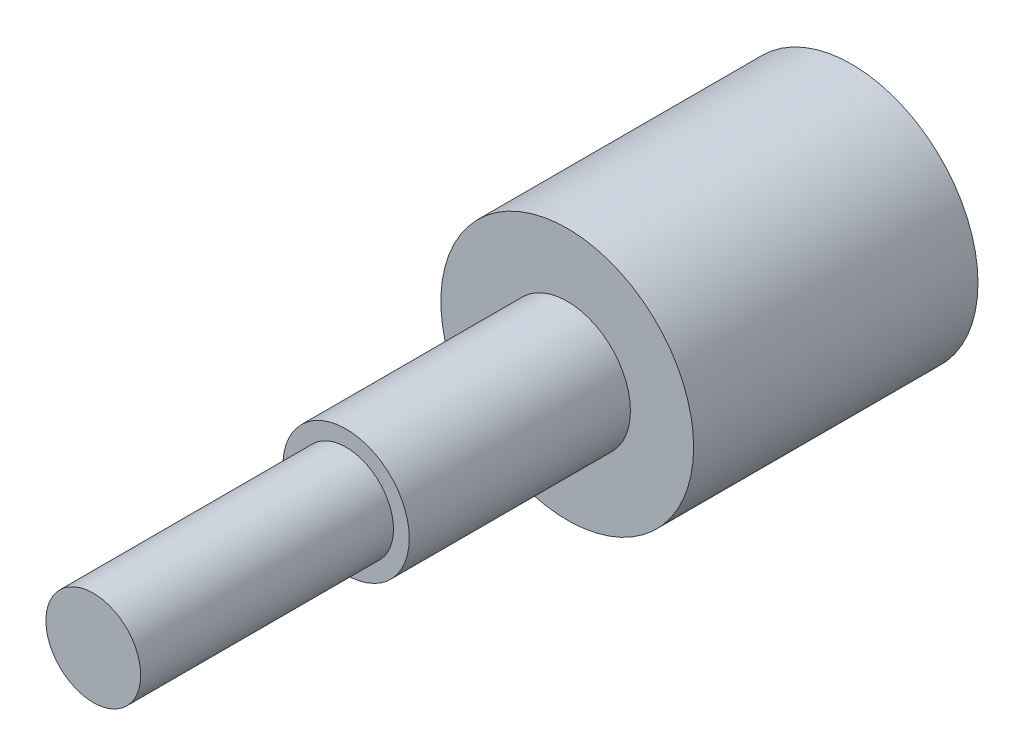
from build123d import *

# Parameters (mm, degrees)
SKETCH1_R           = 4
BOSS_EXTRUDE1_DEPTH = 9
SKETCH2_R           = 2
BOSS_EXTRUDE2_DEPTH = 7
SKETCH3_R           = 1.5
BOSS_EXTRUDE3_DEPTH = 8


with BuildPart() as part:
    # Sketch1 → Boss-Extrude1 (new body)
    with BuildSketch(Plane.XY):
        Circle(SKETCH1_R)
    extrude(amount=BOSS_EXTRUDE1_DEPTH)

    # Sketch2 → Boss-Extrude2 (add)
    with BuildSketch(Plane.XY.offset(9)):
        Circle(SKETCH2_R)
    extrude(amount=BOSS_EXTRUDE2_DEPTH)

    # Sketch3 → Boss-Extrude3 (add)
    with BuildSketch(Plane.XY.offset(16)):
        Circle(SKETCH3_R)
    extrude(amount=BOSS_EXTRUDE3_DEPTH)


solid = part.part
